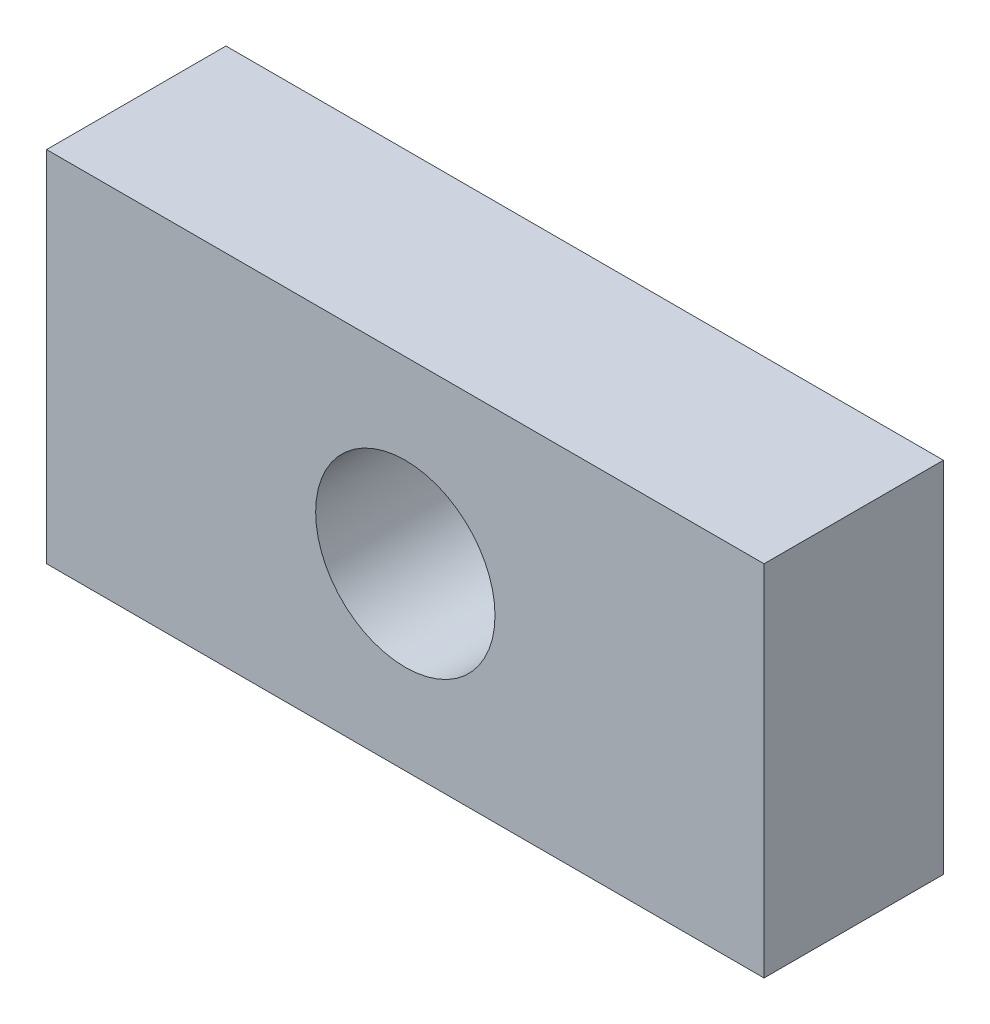
from build123d import *

# Parameters (mm, degrees)
SKETCH1_W           = 40
SKETCH1_H           = 20
BOSS_EXTRUDE1_DEPTH = 10
SKETCH2_R           = 5
CUT_EXTRUDE1_DEPTH  = 46.82575695


with BuildPart() as part:
    # Sketch1 → Boss-Extrude1 (new body)
    with BuildSketch(Plane.XY):
        with Locations((20, 10)):
            Rectangle(SKETCH1_W, SKETCH1_H)
    extrude(amount=BOSS_EXTRUDE1_DEPTH)

    # Sketch2 → Cut-Extrude1 (cut, through all)
    with BuildSketch(Plane.XY.offset(10)):
        with Locations((20, 10)):
            Circle(SKETCH2_R)
    extrude(amount=-CUT_EXTRUDE1_DEPTH, mode=Mode.SUBTRACT)


solid = part.part
